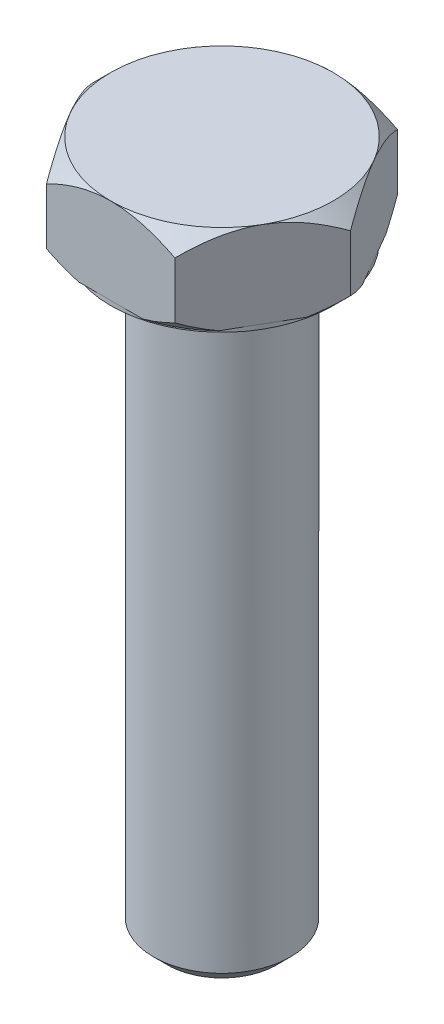
from build123d import *

# Parameters (mm, degrees)
BOSS_EXTRUDE1_DEPTH = 5.3
SKETCH2_OUTSIDE_W   = 21.122
SKETCH2_OUTSIDE_H   = 19.11
SKETCH2_OUTSIDE_R   = 6.5
CUT_EXTRUDE1_DEPTH  = 0.265
SKETCH3_R           = 4
BOSS_EXTRUDE2_DEPTH = 35
CHAMFER1_SIZE       = 0.8


with BuildPart() as part:
    # Sketch1 → Boss-Extrude1 (new body)
    with BuildSketch(Plane(origin=(0, 0, 0), x_dir=(1, 0, 0), z_dir=(0, 1, 0))):
        Polygon((7.505553499, 0), (3.75277675, 6.5), (-3.75277675, 6.5), (-7.505553499, 0), (-3.75277675, -6.5), (3.75277675, -6.5), align=None)
    extrude(amount=-BOSS_EXTRUDE1_DEPTH)

    # Sketch4 → Cut-Revolve1 (revolve, cut)
    with BuildSketch(Plane(origin=(0, 0, 0), x_dir=(0, 0, -1), z_dir=(1, 0, 0))):
        Polygon((-6.5, 0), (-8.15, 0), (-8.15, -1.65), align=None)
        Polygon((-8.15, -3.65), (-6.5, -5.3), (-8.15, -5.3), align=None)
    revolve(axis=Axis((0, 0, 0), (0, -1, 0)), mode=Mode.SUBTRACT)

    # Sketch2 outside → Cut-Extrude1 (cut)
    with BuildSketch(Plane.XZ.offset(5.3)):
        Rectangle(SKETCH2_OUTSIDE_W, SKETCH2_OUTSIDE_H)
        with Locations(Location((0, 0, 0), (0, 0, 90))):
            Circle(SKETCH2_OUTSIDE_R, mode=Mode.SUBTRACT)
    extrude(amount=-CUT_EXTRUDE1_DEPTH, mode=Mode.SUBTRACT)

    # Sketch3 → Boss-Extrude2 (add)
    with BuildSketch(Plane.XZ.offset(5.3)):
        with Locations(Location((0, 0, 0), (0, 0, 90))):
            Circle(SKETCH3_R)
    extrude(amount=BOSS_EXTRUDE2_DEPTH)

    # Chamfer1
    chamfer1_edges = [part.edges().sort_by_distance(p)[0] for p in [
        (0, -40.3, -4),
    ]]
    chamfer(chamfer1_edges, length=CHAMFER1_SIZE)


solid = part.part
